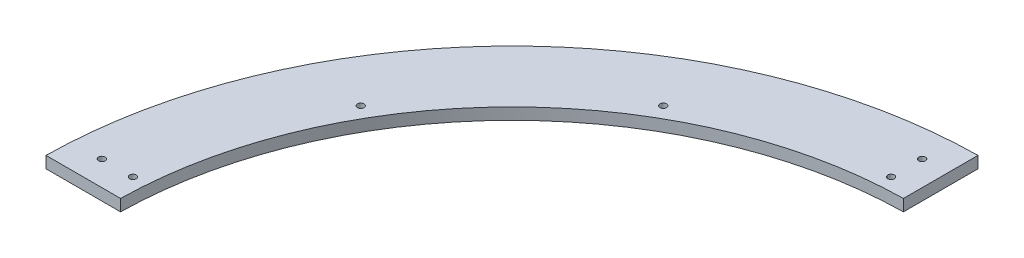
from build123d import *

# Parameters (mm, degrees)
BOSS_EXTRUDE1_DEPTH     = 11.90625
SKETCH2_W               = 12.7
SKETCH2_H               = 38.149612403
SKETCH2_W_2             = 38.149612403
SKETCH2_H_2             = 12.7
CUT_EXTRUDE1_DEPTH      = 683.603309975
F_1_4_CLEARANCE_HOLE1_D = 6.7564
SKETCH8_W               = 482.6
SKETCH8_H               = 482.6
CUT_EXTRUDE4_DEPTH      = 683.603309975
SKETCH12_W              = 6.35
SKETCH12_H              = 76.249612403
SKETCH12_W_2            = 76.249612403
SKETCH12_H_2            = 6.35
CUT_EXTRUDE6_DEPTH      = 683.603309975


with BuildPart() as part:
    # Sketch1 → Boss-Extrude1 (new body)
    with BuildSketch(Plane(origin=(0, 0, 0), x_dir=(1, 0, 0), z_dir=(0, 1, 0))):
        with BuildLine():
            Line((-406.4, 0), (-482.6, 0))
            ThreePointArc((-482.6, 0), (0, 482.6), (482.6, 0))
            Line((482.6, 0), (406.4, 0))
            ThreePointArc((406.4, 0), (0, 406.4), (-406.4, 0))
        make_face()
    extrude(amount=BOSS_EXTRUDE1_DEPTH)

    # Sketch2 → Cut-Extrude1 (cut, through all)
    with BuildSketch(Plane(origin=(0, 11.90625, 0), x_dir=(1, 0, 0), z_dir=(0, 1, 0))):
        with Locations((0, 425.425193799)):
            Rectangle(SKETCH2_W, SKETCH2_H)
        with Locations((425.425193799, 0)):
            Rectangle(SKETCH2_W_2, SKETCH2_H_2)
        with Locations((0, -425.425193799)):
            Rectangle(SKETCH2_W, SKETCH2_H)
        with Locations((-425.425193799, 0)):
            Rectangle(SKETCH2_W_2, SKETCH2_H_2)
    extrude(amount=-CUT_EXTRUDE1_DEPTH, mode=Mode.SUBTRACT)

    # 1/4 Clearance Hole1 (through all)
    with Locations(Plane(origin=(0, 11.90625, 0), x_dir=(1, 0, 0), z_dir=(0, 1, 0))):
        with Locations((-365.700877383, 211.1375), (-31.75, 419.1), (-31.75, 450.85), (-419.1, 31.75), (-450.85, 31.75), (-211.1375, 365.700877383)):
            Hole(F_1_4_CLEARANCE_HOLE1_D / 2)

    # Sketch8 → Cut-Extrude4 (cut, through all)
    with BuildSketch(Plane(origin=(0, 11.90625, 0), x_dir=(1, 0, 0), z_dir=(0, 1, 0))):
        with Locations((241.3, 241.3)):
            Rectangle(SKETCH8_W, SKETCH8_H)
    extrude(amount=-CUT_EXTRUDE4_DEPTH, mode=Mode.SUBTRACT)

    # Sketch12 → Cut-Extrude6 (cut, through all)
    with BuildSketch(Plane(origin=(0, 11.90625, 0), x_dir=(1, 0, 0), z_dir=(0, 1, 0))):
        with Locations((-3.175, 444.475193799)):
            Rectangle(SKETCH12_W, SKETCH12_H)
        with Locations((-444.475193799, 3.175)):
            Rectangle(SKETCH12_W_2, SKETCH12_H_2)
    extrude(amount=-CUT_EXTRUDE6_DEPTH, mode=Mode.SUBTRACT)


solid = part.part
